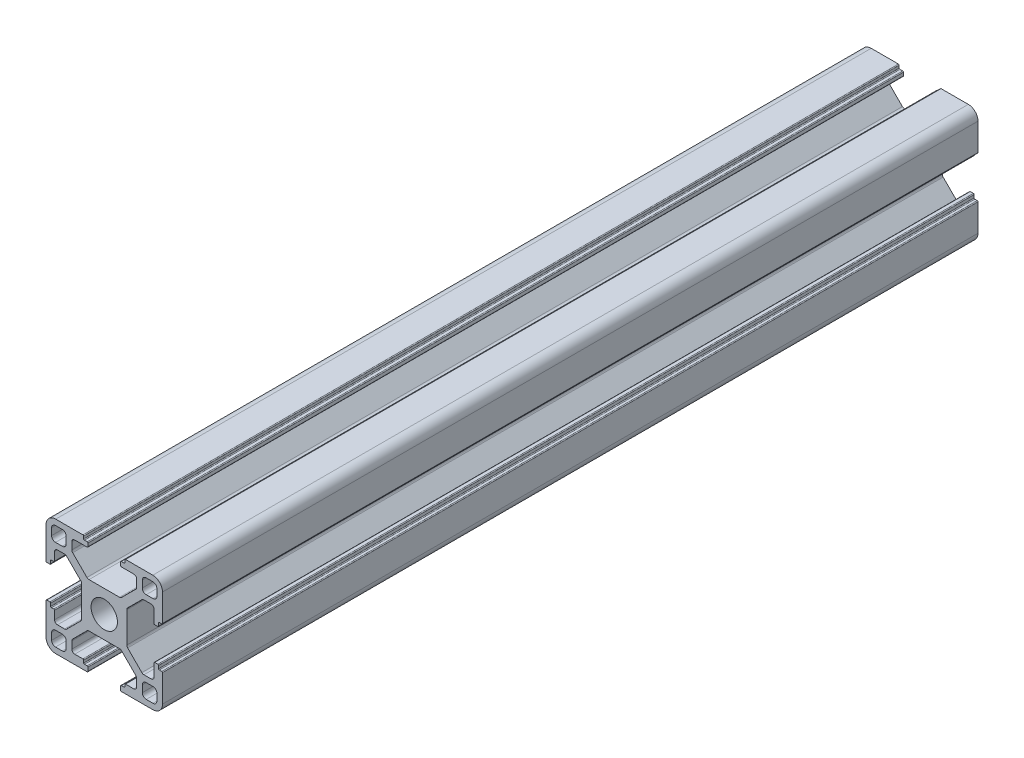
from build123d import *

# Parameters (mm, degrees)
SKETCH1_R           = 3.4
BOSS_EXTRUDE1_DEPTH = 210


with BuildPart() as part:
    # Sketch1 → Boss-Extrude1 (new body)
    with BuildSketch(Plane.XY):
        with BuildLine():
            Line((0, 2.5), (0, 10.6))
            ThreePointArc((0, 10.6), (0.058578644, 10.741421356), (0.2, 10.8))
            Line((0.2, 10.8), (1, 10.8))
            ThreePointArc((1, 10.8), (1.141421356, 10.741421356), (1.2, 10.6))
            Line((1.2, 10.6), (1.2, 9.9))
            ThreePointArc((1.2, 9.9), (1.258578644, 9.758578644), (1.4, 9.7))
            Line((1.4, 9.7), (2, 9.7))
            ThreePointArc((2, 9.7), (2.141421356, 9.641421356), (2.2, 9.5))
            Line((2.2, 9.5), (2.2, 7.4))
            ThreePointArc((2.2, 7.4), (2.419669914, 6.869669914), (2.95, 6.65))
            Line((2.95, 6.65), (4.78370491, 6.65))
            ThreePointArc((4.78370491, 6.65), (5.070717484, 6.707090351), (5.314034995, 6.869669914))
            Line((5.314034995, 6.869669914), (8.980330086, 10.535965005))
            ThreePointArc((8.980330086, 10.535965005), (9.142909649, 10.779282516), (9.2, 11.06629509))
            Line((9.2, 11.06629509), (9.2, 18.93370491))
            ThreePointArc((9.2, 18.93370491), (9.142909649, 19.220717484), (8.980330086, 19.464034995))
            Line((8.980330086, 19.464034995), (5.314034995, 23.130330086))
            ThreePointArc((5.314034995, 23.130330086), (5.070717484, 23.292909649), (4.78370491, 23.35))
            Line((4.78370491, 23.35), (2.95, 23.35))
            ThreePointArc((2.95, 23.35), (2.419669914, 23.130330086), (2.2, 22.6))
            Line((2.2, 22.6), (2.2, 20.5))
            ThreePointArc((2.2, 20.5), (2.141421356, 20.358578644), (2, 20.3))
            Line((2, 20.3), (1.4, 20.3))
            ThreePointArc((1.4, 20.3), (1.258578644, 20.241421356), (1.2, 20.1))
            Line((1.2, 20.1), (1.2, 19.4))
            ThreePointArc((1.2, 19.4), (1.141421356, 19.258578644), (1, 19.2))
            Line((1, 19.2), (0.2, 19.2))
            ThreePointArc((0.2, 19.2), (0.058578644, 19.258578644), (0, 19.4))
            Line((0, 19.4), (0, 27.5))
            ThreePointArc((0, 27.5), (0.732233047, 29.267766953), (2.5, 30))
            Line((2.5, 30), (9.5, 30))
            ThreePointArc((9.5, 30), (9.641421356, 29.941421356), (9.7, 29.8))
            Line((9.7, 29.8), (9.7, 29.2))
            ThreePointArc((9.7, 29.2), (9.758578644, 29.058578644), (9.9, 29))
            Line((9.9, 29), (10.6, 29))
            ThreePointArc((10.6, 29), (10.741421356, 28.941421356), (10.8, 28.8))
            Line((10.8, 28.8), (10.8, 28))
            ThreePointArc((10.8, 28), (10.741421356, 27.858578644), (10.6, 27.8))
            Line((10.6, 27.8), (7.4, 27.8))
            ThreePointArc((7.4, 27.8), (6.869669914, 27.580330086), (6.65, 27.05))
            Line((6.65, 27.05), (6.65, 25.21629509))
            ThreePointArc((6.65, 25.21629509), (6.707090351, 24.929282516), (6.869669914, 24.685965005))
            Line((6.869669914, 24.685965005), (10.535965005, 21.019669914))
            ThreePointArc((10.535965005, 21.019669914), (10.779282516, 20.857090351), (11.06629509, 20.8))
            Line((11.06629509, 20.8), (18.93370491, 20.8))
            ThreePointArc((18.93370491, 20.8), (19.220717484, 20.857090351), (19.464034995, 21.019669914))
            Line((19.464034995, 21.019669914), (23.130330086, 24.685965005))
            ThreePointArc((23.130330086, 24.685965005), (23.292909649, 24.929282516), (23.35, 25.21629509))
            Line((23.35, 25.21629509), (23.35, 27.05))
            ThreePointArc((23.35, 27.05), (23.130330086, 27.580330086), (22.6, 27.8))
            Line((22.6, 27.8), (19.4, 27.8))
            ThreePointArc((19.4, 27.8), (19.258578644, 27.858578644), (19.2, 28))
            Line((19.2, 28), (19.2, 28.8))
            ThreePointArc((19.2, 28.8), (19.258578644, 28.941421356), (19.4, 29))
            Line((19.4, 29), (20.1, 29))
            ThreePointArc((20.1, 29), (20.241421356, 29.058578644), (20.3, 29.2))
            Line((20.3, 29.2), (20.3, 29.8))
            ThreePointArc((20.3, 29.8), (20.358578644, 29.941421356), (20.5, 30))
            Line((20.5, 30), (27.5, 30))
            ThreePointArc((27.5, 30), (29.267766953, 29.267766953), (30, 27.5))
            Line((30, 27.5), (30, 20.5))
            ThreePointArc((30, 20.5), (29.941421356, 20.358578644), (29.8, 20.3))
            Line((29.8, 20.3), (29.2, 20.3))
            ThreePointArc((29.2, 20.3), (29.058578644, 20.241421356), (29, 20.1))
            Line((29, 20.1), (29, 19.4))
            ThreePointArc((29, 19.4), (28.941421356, 19.258578644), (28.8, 19.2))
            Line((28.8, 19.2), (28, 19.2))
            ThreePointArc((28, 19.2), (27.858578644, 19.258578644), (27.8, 19.4))
            Line((27.8, 19.4), (27.8, 22.6))
            ThreePointArc((27.8, 22.6), (27.580330086, 23.130330086), (27.05, 23.35))
            Line((27.05, 23.35), (25.21629509, 23.35))
            ThreePointArc((25.21629509, 23.35), (24.929282516, 23.292909649), (24.685965005, 23.130330086))
            Line((24.685965005, 23.130330086), (21.019669914, 19.464034995))
            ThreePointArc((21.019669914, 19.464034995), (20.857090351, 19.220717484), (20.8, 18.93370491))
            Line((20.8, 18.93370491), (20.8, 11.06629509))
            ThreePointArc((20.8, 11.06629509), (20.857090351, 10.779282516), (21.019669914, 10.535965005))
            Line((21.019669914, 10.535965005), (24.685965005, 6.869669914))
            ThreePointArc((24.685965005, 6.869669914), (24.929282516, 6.707090351), (25.21629509, 6.65))
            Line((25.21629509, 6.65), (27.05, 6.65))
            ThreePointArc((27.05, 6.65), (27.580330086, 6.869669914), (27.8, 7.4))
            Line((27.8, 7.4), (27.8, 10.6))
            ThreePointArc((27.8, 10.6), (27.858578644, 10.741421356), (28, 10.8))
            Line((28, 10.8), (28.8, 10.8))
            ThreePointArc((28.8, 10.8), (28.941421356, 10.741421356), (29, 10.6))
            Line((29, 10.6), (29, 9.9))
            ThreePointArc((29, 9.9), (29.058578644, 9.758578644), (29.2, 9.7))
            Line((29.2, 9.7), (29.8, 9.7))
            ThreePointArc((29.8, 9.7), (29.941421356, 9.641421356), (30, 9.5))
            Line((30, 9.5), (30, 2.5))
            ThreePointArc((30, 2.5), (29.267766953, 0.732233047), (27.5, 0))
            Line((27.5, 0), (19.4, 0))
            ThreePointArc((19.4, 0), (19.258578644, 0.058578644), (19.2, 0.2))
            Line((19.2, 0.2), (19.2, 1.132430858))
            ThreePointArc((19.2, 1.132430858), (19.258578644, 1.273852214), (19.4, 1.332430858))
            Line((19.4, 1.332430858), (20.1, 1.332430858))
            ThreePointArc((20.1, 1.332430858), (20.241421356, 1.391009502), (20.3, 1.532430858))
            Line((20.3, 1.532430858), (20.3, 2))
            ThreePointArc((20.3, 2), (20.358578644, 2.141421356), (20.5, 2.2))
            Line((20.5, 2.2), (22.6, 2.2))
            ThreePointArc((22.6, 2.2), (23.130330086, 2.419669914), (23.35, 2.95))
            Line((23.35, 2.95), (23.35, 4.916135768))
            ThreePointArc((23.35, 4.916135768), (23.292909649, 5.203148342), (23.130330086, 5.446465854))
            Line((23.130330086, 5.446465854), (19.464034995, 9.112760944))
            ThreePointArc((19.464034995, 9.112760944), (19.220717484, 9.275340508), (18.93370491, 9.332430858))
            Line((18.93370491, 9.332430858), (11.06629509, 9.332430858))
            ThreePointArc((11.06629509, 9.332430858), (10.779282516, 9.275340508), (10.535965005, 9.112760944))
            Line((10.535965005, 9.112760944), (6.869669914, 5.446465854))
            ThreePointArc((6.869669914, 5.446465854), (6.707090351, 5.203148342), (6.65, 4.916135768))
            Line((6.65, 4.916135768), (6.65, 3.082430858))
            ThreePointArc((6.65, 3.082430858), (6.869669914, 2.552100772), (7.4, 2.332430858))
            Line((7.4, 2.332430858), (9.5, 2.332430858))
            ThreePointArc((9.5, 2.332430858), (9.641421356, 2.273852214), (9.7, 2.132430858))
            Line((9.7, 2.132430858), (9.7, 1.532430858))
            ThreePointArc((9.7, 1.532430858), (9.758578644, 1.391009502), (9.9, 1.332430858))
            Line((9.9, 1.332430858), (10.6, 1.332430858))
            ThreePointArc((10.6, 1.332430858), (10.741421356, 1.273852214), (10.8, 1.132430858))
            Line((10.8, 1.132430858), (10.8, 0.2))
            ThreePointArc((10.8, 0.2), (10.741421356, 0.058578644), (10.6, 0))
            Line((10.6, 0), (2.5, 0))
            ThreePointArc((2.5, 0), (0.732233047, 0.732233047), (0, 2.5))
        make_face()
        with Locations((15, 15)):
            Circle(SKETCH1_R, mode=Mode.SUBTRACT)
        with BuildLine():
            Line((27.55, 1.45), (25.8, 1.45))
            ThreePointArc((25.8, 1.45), (25.092893219, 1.742893219), (24.8, 2.45))
            Line((24.8, 2.45), (24.8, 4.2))
            ThreePointArc((24.8, 4.2), (25.092893219, 4.907106781), (25.8, 5.2))
            Line((25.8, 5.2), (27.55, 5.2))
            ThreePointArc((27.55, 5.2), (28.257106781, 4.907106781), (28.55, 4.2))
            Line((28.55, 4.2), (28.55, 2.45))
            ThreePointArc((28.55, 2.45), (28.257106781, 1.742893219), (27.55, 1.45))
        make_face(mode=Mode.SUBTRACT)
        with BuildLine():
            Line((24.8, 25.8), (24.8, 27.55))
            ThreePointArc((24.8, 27.55), (25.092893219, 28.257106781), (25.8, 28.55))
            Line((25.8, 28.55), (27.55, 28.55))
            ThreePointArc((27.55, 28.55), (28.257106781, 28.257106781), (28.55, 27.55))
            Line((28.55, 27.55), (28.55, 25.8))
            ThreePointArc((28.55, 25.8), (28.257106781, 25.092893219), (27.55, 24.8))
            Line((27.55, 24.8), (25.8, 24.8))
            ThreePointArc((25.8, 24.8), (25.092893219, 25.092893219), (24.8, 25.8))
        make_face(mode=Mode.SUBTRACT)
        with BuildLine():
            Line((2.45, 28.55), (4.2, 28.55))
            ThreePointArc((4.2, 28.55), (4.907106781, 28.257106781), (5.2, 27.55))
            Line((5.2, 27.55), (5.2, 25.8))
            ThreePointArc((5.2, 25.8), (4.907106781, 25.092893219), (4.2, 24.8))
            Line((4.2, 24.8), (2.45, 24.8))
            ThreePointArc((2.45, 24.8), (1.742893219, 25.092893219), (1.45, 25.8))
            Line((1.45, 25.8), (1.45, 27.55))
            ThreePointArc((1.45, 27.55), (1.742893219, 28.257106781), (2.45, 28.55))
        make_face(mode=Mode.SUBTRACT)
        with BuildLine():
            Line((1.45, 2.45), (1.45, 4.2))
            ThreePointArc((1.45, 4.2), (1.742893219, 4.907106781), (2.45, 5.2))
            Line((2.45, 5.2), (4.2, 5.2))
            ThreePointArc((4.2, 5.2), (4.907106781, 4.907106781), (5.2, 4.2))
            Line((5.2, 4.2), (5.2, 2.45))
            ThreePointArc((5.2, 2.45), (4.907106781, 1.742893219), (4.2, 1.45))
            Line((4.2, 1.45), (2.45, 1.45))
            ThreePointArc((2.45, 1.45), (1.742893219, 1.742893219), (1.45, 2.45))
        make_face(mode=Mode.SUBTRACT)
    extrude(amount=BOSS_EXTRUDE1_DEPTH)


solid = part.part
